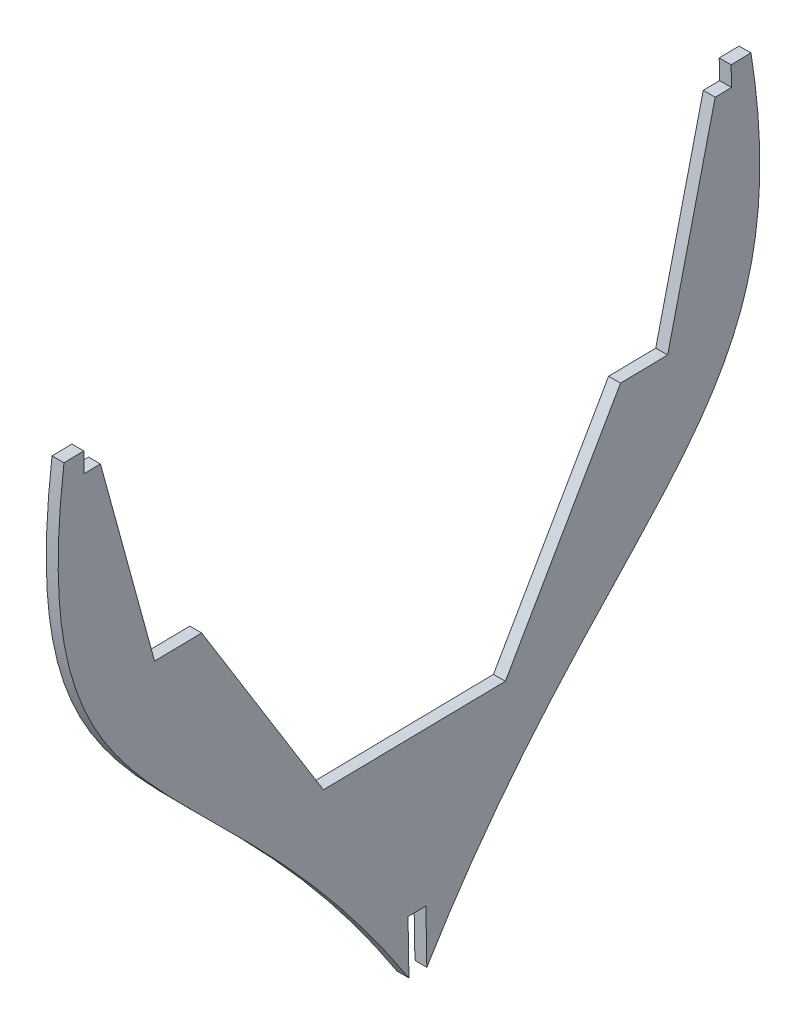
from build123d import *

# Parameters (mm, degrees)
BOSS_EXTRU_3_DEPTH      = 6
ENL_V_MAT_EXTRU_2_DEPTH = 6


with BuildPart() as part:
    # Esquisse2 → Boss.-Extru.3 (new body)
    with BuildSketch(Plane(origin=(0, 0, 0), x_dir=(0, 0, -1), z_dir=(1, 0, 0))):
        with BuildLine():
            Line((-178.714049927, 346.361590687), (-168.714049927, 346.52802049))
            Line((-168.714049927, 346.52802049), (-168.547620124, 336.52802049))
            Line((-168.547620124, 336.52802049), (-160.353403431, 336.664396677))
            Line((-160.353403431, 336.664396677), (-133.106726849, 237.104014099))
            Line((-133.106726849, 237.104014099), (-109.381027038, 237.498880454))
            Line((-109.381027038, 237.498880454), (-48.107797435, 138.504801128))
            Line((-48.107797435, 138.504801128), (43.47216545, 140.028964649))
            Line((43.47216545, 140.028964649), (101.417259884, 241.007192197))
            Line((101.417259884, 241.007192197), (125.142959695, 241.402058552))
            Line((125.142959695, 241.402058552), (149.061501107, 341.813982847))
            Line((149.061501107, 341.813982847), (157.255717801, 341.950359034))
            Line((157.255717801, 341.950359034), (157.089287998, 351.950359034))
            Line((157.089287998, 351.950359034), (167.089287998, 352.116788837))
            add(Edge.make_bspline(
                [(167.089287998, 352.116788837), (193.627788773, 185.593330999), (97.131399781, 194.372569312), (-0.461809734, 27.748018973)],
                knots=[0, 0, 0, 0, 1, 1, 1, 1], degree=3))
            add(Edge.make_bspline(
                [(-178.714049927, 346.361590687), (-199.696494668, 179.047242687), (-103.54569217, 191.032704418), (-0.461809734, 27.748018973)],
                knots=[0, 0, 0, 0, 1, 1, 1, 1], degree=3))
        make_face()
    extrude(amount=BOSS_EXTRU_3_DEPTH)

    # Esquisse3 → Enlèv. mat.-Extru.2 (cut)
    with BuildSketch(Plane(origin=(6, 0, 0), x_dir=(0, 0, -1), z_dir=(1, 0, 0))):
        Polygon((-5.083077927, 34.959572472), (-5.532438395, 61.959572472), (3.467561605, 62.109359295), (3.916922073, 35.109359295), (19.621136425, 18.873128295), (-16.545154168, 18.873128295), align=None)
    extrude(amount=-ENL_V_MAT_EXTRU_2_DEPTH, mode=Mode.SUBTRACT)


solid = part.part
